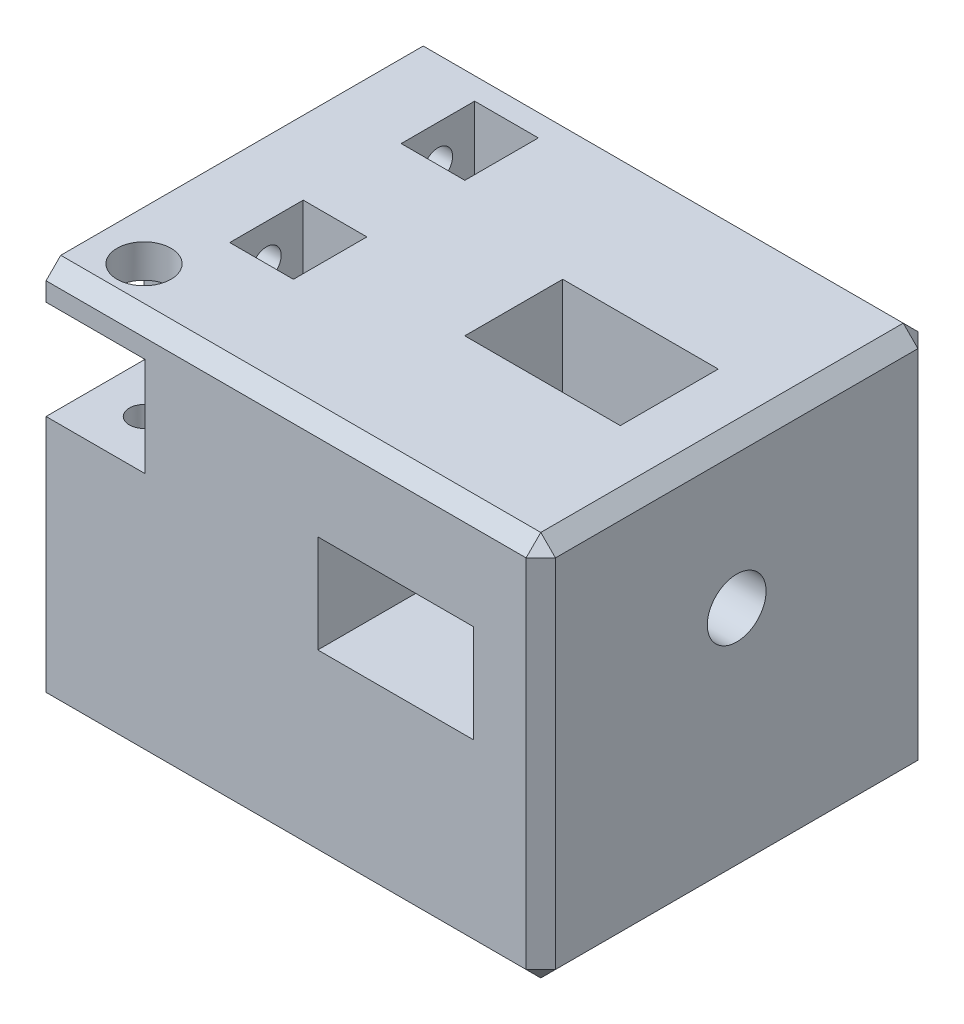
from build123d import *

# Parameters (mm, degrees)
SKETCH1_W               = 78.778264774
SKETCH1_H               = 80
BOSS_EXTRUDE1_DEPTH     = 45
SKETCH2_W               = 20.2
SKETCH2_H               = 20.2
CUT_EXTRUDE1_DEPTH      = 20
CUT_EXTRUDE2_DEPTH      = 1226.691607852
CUT_EXTRUDE2_DEPTH_BACK = 1226.691607852
SKETCH4_W               = 78.778264774
SKETCH4_H               = 80
BOSS_EXTRUDE2_DEPTH     = 56
CUT_EXTRUDE3_START      = -50.519806
SKETCH5_R               = 10
CUT_EXTRUDE3_DEPTH      = 50.519818
SKETCH6_R               = 3.4
BOSS_EXTRUDE3_DEPTH     = 12
SKETCH7_R               = 10
BOSS_EXTRUDE4_DEPTH     = 5
SKETCH8_R               = 3.4
BOSS_EXTRUDE5_DEPTH     = 1.5
SKETCH9_R               = 10
BOSS_EXTRUDE6_DEPTH     = 13.769806202
SKETCH10_W              = 31.75
SKETCH10_H              = 20
CUT_EXTRUDE4_DEPTH      = 41
SKETCH13_W              = 30.362291711
SKETCH13_H              = 20
CUT_EXTRUDE5_DEPTH      = 31.75
SKETCH11_R              = 3.4
BOSS_EXTRUDE7_DEPTH     = 14
SKETCH12_R              = 3.4
BOSS_EXTRUDE8_DEPTH     = 1.5
CUT_EXTRUDE6_DEPTH      = 1382.374333236
CUT_EXTRUDE6_DEPTH_BACK = 1382.374333236
SKETCH14_R              = 2.5
CUT_EXTRUDE7_DEPTH      = 1384.878879614
CUT_EXTRUDE7_DEPTH_BACK = 10
SKETCH15_R              = 6
CUT_EXTRUDE8_DEPTH      = 45
SKETCH17_R              = 3
CUT_EXTRUDE9_DEPTH      = 45
SKETCH18_W              = 13
SKETCH18_H              = 15
CUT_EXTRUDE10_DEPTH     = 21
SKETCH19_W              = 13
SKETCH19_H              = 15
CUT_EXTRUDE11_DEPTH     = 21
CHAMFER1_SIZE           = 3
SKETCH20_R              = 5.5
CUT_EXTRUDE12_DEPTH     = 8
CUT_EXTRUDE13_START     = -8
SKETCH21_R              = 5.5
CUT_EXTRUDE13_DEPTH     = 8


with BuildPart() as part:
    # Sketch1 → Boss-Extrude1 (new body)
    with BuildSketch(Plane.YZ):
        with Locations((-601.571748543, 1182.329293832)):
            Rectangle(SKETCH1_W, SKETCH1_H)
    extrude(amount=BOSS_EXTRUDE1_DEPTH)

    # Sketch2 → Cut-Extrude1 (cut)
    with BuildSketch(Plane.XY.offset(1222.329293832)):
        with Locations((10.1, -579.082515944)):
            Rectangle(SKETCH2_W, SKETCH2_H)
    extrude(amount=-CUT_EXTRUDE1_DEPTH, mode=Mode.SUBTRACT)

    # Sketch3 → Cut-Extrude2 (cut, two sides: drawn at the far end of the back side and taken through both)
    with BuildSketch(Plane(origin=(0, -562.182616156, 0), x_dir=(-1, 0, 0), z_dir=(0, 1, 0)).offset(-CUT_EXTRUDE2_DEPTH_BACK)):
        with BuildLine():
            ThreePointArc((-11.102244776, 1215.119465234), (-13, 1212.329293832), (-11.102244776, 1209.53912243))
            Line((-11.102244776, 1209.53912243), (-11.102244776, 1215.119465234))
        make_face()
        with BuildLine():
            Line((-11.102244776, 1215.119465234), (-11.102244776, 1209.53912243))
            ThreePointArc((-11.102244776, 1209.53912243), (-10, 1209.329293832), (-8.897755224, 1209.53912243))
            Line((-8.897755224, 1209.53912243), (-8.897755224, 1215.119465234))
            ThreePointArc((-8.897755224, 1215.119465234), (-10, 1215.329293832), (-11.102244776, 1215.119465234))
        make_face()
        with BuildLine():
            Line((-8.897755224, 1215.119465234), (-8.897755224, 1209.53912243))
            ThreePointArc((-8.897755224, 1209.53912243), (-7.519401853, 1210.642097093), (-7, 1212.329293832))
            ThreePointArc((-7, 1212.329293832), (-7.519401853, 1214.016490571), (-8.897755224, 1215.119465234))
        make_face()
    extrude(amount=CUT_EXTRUDE2_DEPTH + CUT_EXTRUDE2_DEPTH_BACK, mode=Mode.SUBTRACT)

    # Sketch4 → Boss-Extrude2 (add)
    with BuildSketch(Plane.YZ.offset(45)):
        with Locations((-601.571748543, 1182.329293832)):
            Rectangle(SKETCH4_W, SKETCH4_H)
    extrude(amount=BOSS_EXTRUDE2_DEPTH)

    # Sketch5 → Cut-Extrude3 (cut)
    with BuildSketch(Plane.YZ.offset(101).offset(CUT_EXTRUDE3_START)):
        with Locations(Location((-592.544907867, 1182.329293832, 0), (0, 0, 270))):
            Circle(SKETCH5_R)
    extrude(amount=CUT_EXTRUDE3_DEPTH, mode=Mode.SUBTRACT)

    # Sketch6 → Boss-Extrude3 (add)
    with BuildSketch(Plane(origin=(57.230193798, 0, 0), x_dir=(0, -1, 0), z_dir=(-1, 0, 0))):
        with Locations(Location((592.544907867, 1182.329293832, 0), (0, 0, 180))):
            Circle(SKETCH6_R)
    extrude(amount=BOSS_EXTRUDE3_DEPTH)

    # Sketch7 → Boss-Extrude4 (add)
    with BuildSketch(Plane.YZ.offset(50.480193798)):
        with Locations(Location((-592.544907867, 1182.329293832, 0), (0, 0, 270))):
            Circle(SKETCH7_R)
    extrude(amount=BOSS_EXTRUDE4_DEPTH)



with BuildPart() as body_2:
    # Sketch8 → Boss-Extrude5 (new body)
    with BuildSketch(Plane.YZ.offset(85.730193798)):
        with Locations((-592.544907867, 1182.329293832)):
            Circle(SKETCH8_R)
    extrude(amount=BOSS_EXTRUDE5_DEPTH)


with BuildPart() as part_1:
    add(part.part)

    add(body_2.part)  # Boss-Extrude6 merges body 2
    # Sketch9 → Boss-Extrude6 (add)
    with BuildSketch(Plane.YZ.offset(87.230193798)):
        with Locations((-592.544907867, 1182.329293832)):
            Circle(SKETCH9_R)
    extrude(amount=BOSS_EXTRUDE6_DEPTH)

    # Sketch10 → Cut-Extrude4 (cut)
    with BuildSketch(Plane.XY.offset(1222.329293832)):
        with Locations((71.355193798, -592.719907867)):
            Rectangle(SKETCH10_W, SKETCH10_H)
    extrude(amount=-CUT_EXTRUDE4_DEPTH, mode=Mode.SUBTRACT)

    # Sketch13 → Cut-Extrude5 (cut)
    with BuildSketch(Plane.YZ.offset(55.480193798)):
        with Locations((-577.363762012, 1182.329293832)):
            Rectangle(SKETCH13_W, SKETCH13_H)
    extrude(amount=CUT_EXTRUDE5_DEPTH, mode=Mode.SUBTRACT)

    # Sketch11 → Boss-Extrude7 (add)
    with BuildSketch(Plane.YZ.offset(57.230193798)):
        with Locations((-592.544907867, 1182.329293832)):
            Circle(SKETCH11_R)
    extrude(amount=-BOSS_EXTRUDE7_DEPTH)

    # Sketch12 → Boss-Extrude8 (add)
    with BuildSketch(Plane(origin=(85.730193798, 0, 0), x_dir=(0, -1, 0), z_dir=(-1, 0, 0))):
        with Locations(Location((592.544907867, 1182.329293832, 0), (0, 0, 180))):
            Circle(SKETCH12_R)
    extrude(amount=-BOSS_EXTRUDE8_DEPTH)

    # Sketch14 → Cut-Extrude6 (cut, two sides: drawn at the far end of the back side and taken through both)
    with BuildSketch(Plane.YZ.offset(57.230193798).offset(-CUT_EXTRUDE6_DEPTH_BACK)):
        with Locations((-592.544907867, 1182.329293832)):
            Circle(SKETCH14_R)
    extrude(amount=CUT_EXTRUDE6_DEPTH + CUT_EXTRUDE6_DEPTH_BACK, mode=Mode.SUBTRACT)

    # Sketch15 → Cut-Extrude7 (cut, two sides: drawn at the far end of the back side and taken through both)
    with BuildSketch(Plane.YZ.offset(101).offset(-CUT_EXTRUDE7_DEPTH_BACK)):
        with Locations(Location((-592.544907867, 1182.329293832, 0), (0, 0, 270))):
            Circle(SKETCH15_R)
    extrude(amount=CUT_EXTRUDE7_DEPTH + CUT_EXTRUDE7_DEPTH_BACK, mode=Mode.SUBTRACT)

    # Sketch16 → Cut-Extrude8 (cut)
    with BuildSketch(Plane(origin=(0, 0, 0), x_dir=(0, -1, 0), z_dir=(-1, 0, 0))):
        Polygon((589.946831656, 1177.829293832), (595.142984078, 1177.829293832), (597.74106029, 1182.329293832), (595.142984078, 1186.829293832), (589.946831656, 1186.829293832), (587.348755444, 1182.329293832), align=None)
    extrude(amount=-CUT_EXTRUDE8_DEPTH, mode=Mode.SUBTRACT)

    # Sketch17 → Cut-Extrude9 (cut)
    with BuildSketch(Plane(origin=(0, 0, 0), x_dir=(0, -1, 0), z_dir=(-1, 0, 0))):
        with Locations(Location((569.682616156, 1157.329293832, 0), (0, 0, 90))):
            Circle(SKETCH17_R)
        with Locations(Location((633.46088093, 1157.329293832, 0), (0, 0, 90))):
            Circle(SKETCH17_R)
        with Locations(Location((569.682616156, 1192.329293832, 0), (0, 0, 90))):
            Circle(SKETCH17_R)
        with Locations(Location((633.46088093, 1192.329293832, 0), (0, 0, 90))):
            Circle(SKETCH17_R)
    extrude(amount=-CUT_EXTRUDE9_DEPTH, mode=Mode.SUBTRACT)

    # Sketch18 → Cut-Extrude10 (cut)
    with BuildSketch(Plane(origin=(0, -562.182616156, 0), x_dir=(-1, 0, 0), z_dir=(0, 1, 0))):
        with Locations((-21.5, 1157.329293832)):
            Rectangle(SKETCH18_W, SKETCH18_H)
        with Locations((-21.5, 1192.329293832)):
            Rectangle(SKETCH18_W, SKETCH18_H)
    extrude(amount=-CUT_EXTRUDE10_DEPTH, mode=Mode.SUBTRACT)

    # Sketch19 → Cut-Extrude11 (cut)
    with BuildSketch(Plane.XZ.offset(640.96088093)):
        with Locations((21.5, 1157.329293832)):
            Rectangle(SKETCH19_W, SKETCH19_H)
        with Locations((21.5, 1192.329293832)):
            Rectangle(SKETCH19_W, SKETCH19_H)
    extrude(amount=-CUT_EXTRUDE11_DEPTH, mode=Mode.SUBTRACT)

    # Chamfer1
    chamfer1_edges = [part_1.edges().sort_by_distance(p)[0] for p in [
        (101, -601.571748543, 1222.329293832),
        (101, -640.96088093, 1182.329293832),
        (101, -601.571748543, 1142.329293832),
        (101, -562.182616156, 1182.329293832),
        (50.5, -640.96088093, 1222.329293832),
        (50.5, -562.182616156, 1222.329293832),
        (50.5, -562.182616156, 1142.329293832),
        (50.5, -640.96088093, 1142.329293832),
    ]]
    chamfer(chamfer1_edges, length=CHAMFER1_SIZE)

    # Sketch20 → Cut-Extrude12 (cut)
    with BuildSketch(Plane(origin=(0, -562.182616156, 0), x_dir=(-1, 0, 0), z_dir=(0, 1, 0))):
        with Locations(Location((-10, 1212.329293832, 0), (0, 0, 90))):
            Circle(SKETCH20_R)
    extrude(amount=-CUT_EXTRUDE12_DEPTH, mode=Mode.SUBTRACT)

    # Sketch21 → Cut-Extrude13 (cut)
    with BuildSketch(Plane.XZ.offset(640.96088093).offset(CUT_EXTRUDE13_START)):
        with Locations(Location((10, 1212.329293832, 0), (0, 0, 90))):
            Circle(SKETCH21_R)
    extrude(amount=CUT_EXTRUDE13_DEPTH, mode=Mode.SUBTRACT)


solid = part_1.part
